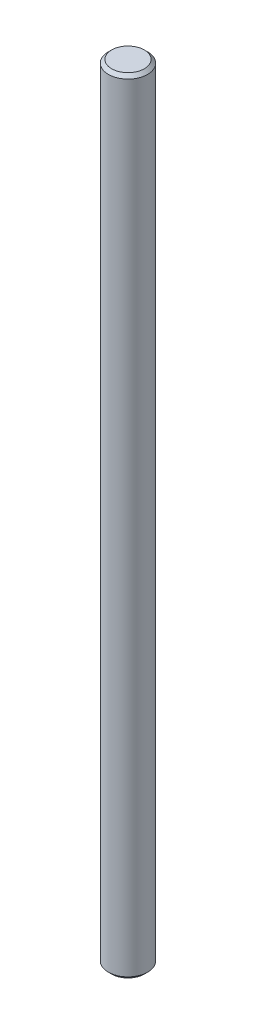
from build123d import *

# Parameters (mm, degrees)
SKETCH1_R      = 6
EXTRUDE1_DEPTH = 240
CHAMFER1_SIZE  = 1


with BuildPart() as part:
    # Sketch1 → Extrude1 (new body)
    with BuildSketch(Plane(origin=(0, 0, 0), x_dir=(1, 0, 0), z_dir=(0, 1, 0))):
        with Locations(Location((0, 0.010418865, 0), (0, 0, 270))):
            Circle(SKETCH1_R)
    extrude(amount=EXTRUDE1_DEPTH)

    # Chamfer1
    chamfer1_edges = [part.edges().sort_by_distance(p)[0] for p in [
        (0, 0, -6.010418865),
        (0, 240, -6.010418865),
    ]]
    chamfer(chamfer1_edges, length=CHAMFER1_SIZE)


solid = part.part
